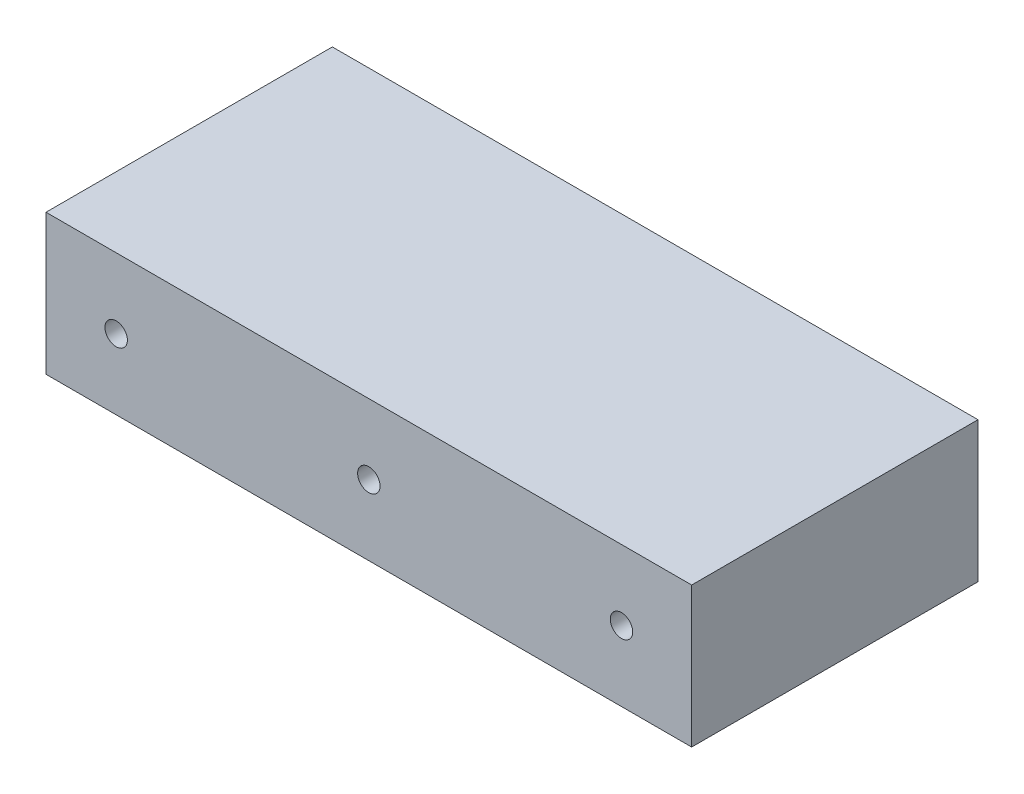
from build123d import *

# Parameters (mm, degrees)
SKETCH2_W           = 230
SKETCH2_H           = 50
BOSS_EXTRUDE1_DEPTH = 102
SKETCH3_R           = 4
CUT_EXTRUDE1_DEPTH  = 156.73695772


with BuildPart() as part:
    # Sketch2 → Boss-Extrude1 (new body)
    with BuildSketch(Plane.XY):
        Rectangle(SKETCH2_W, SKETCH2_H)
    extrude(amount=BOSS_EXTRUDE1_DEPTH)

    # Sketch3 → Cut-Extrude1 (cut, through all)
    with BuildSketch(Plane.XY.offset(102)):
        Circle(SKETCH3_R)
        with Locations((90, 0)):
            Circle(SKETCH3_R)
        with Locations((-90, 0)):
            Circle(SKETCH3_R)
    extrude(amount=-CUT_EXTRUDE1_DEPTH, mode=Mode.SUBTRACT)


solid = part.part
